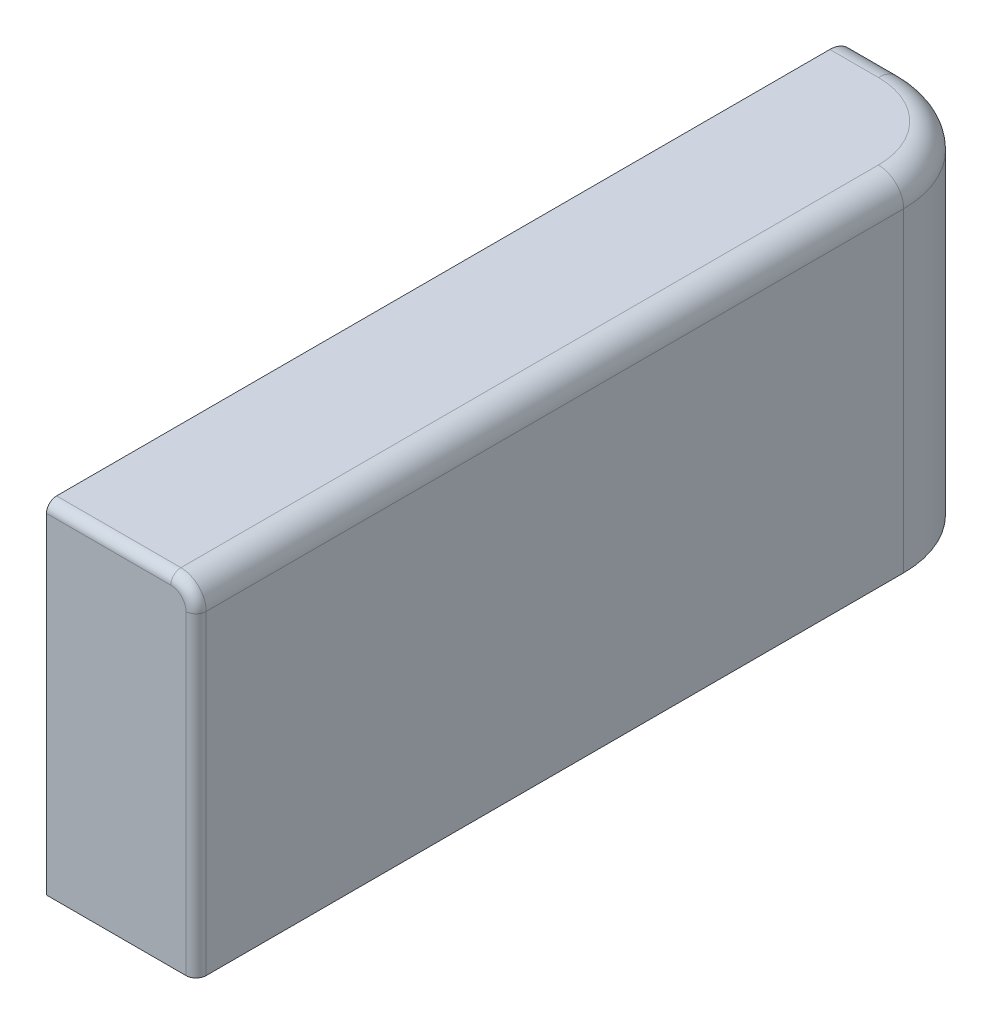
from build123d import *

# Parameters (mm, degrees)
EXTRUDE_1_DEPTH = 337
FILLET_1_R      = 25
FILLET_2_R      = 10


with BuildPart() as part:
    # 스케치1 → 보스-돌출1 (new body)
    with BuildSketch(Plane(origin=(0, 0, 0), x_dir=(1, 0, 0), z_dir=(0, 1, 0))):
        with BuildLine():
            Line((0, 0), (0, 800))
            Line((0, 800), (48, 800))
            ThreePointArc((48, 800), (118.710678119, 770.710678119), (148, 700))
            Line((148, 700), (148, 0))
            Line((148, 0), (0, 0))
        make_face()
    extrude(amount=EXTRUDE_1_DEPTH)

    # 필렛1
    fillet_1_edges = [part.edges().sort_by_distance(p)[0] for p in [
        (118.710678119, 337, -770.710678119),
        (24, 337, -800),
        (148, 337, -350),
    ]]
    fillet(fillet_1_edges, radius=FILLET_1_R)

    # 필렛2
    fillet_2_edges = [part.edges().sort_by_distance(p)[0] for p in [
        (148, 156, 0),
        (140.67766953, 329.67766953, 0),
        (61.5, 337, 0),
    ]]
    fillet(fillet_2_edges, radius=FILLET_2_R)


solid = part.part
